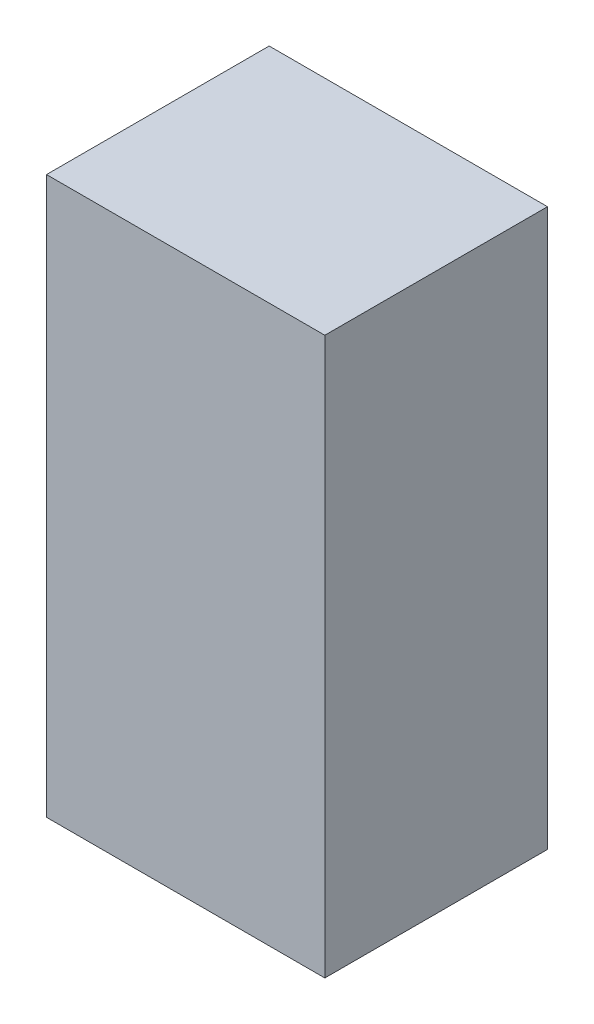
from build123d import *

# Parameters (mm, degrees)
SKETCH1_W           = 10
SKETCH1_H           = 25
BOSS_EXTRUDE1_DEPTH = 12.5


with BuildPart() as part:
    # Sketch1 → Boss-Extrude1 (new body)
    with BuildSketch(Plane(origin=(0, 0, 0), x_dir=(0, 0, -1), z_dir=(1, 0, 0))):
        Rectangle(SKETCH1_W, SKETCH1_H)
    extrude(amount=BOSS_EXTRUDE1_DEPTH)


solid = part.part
